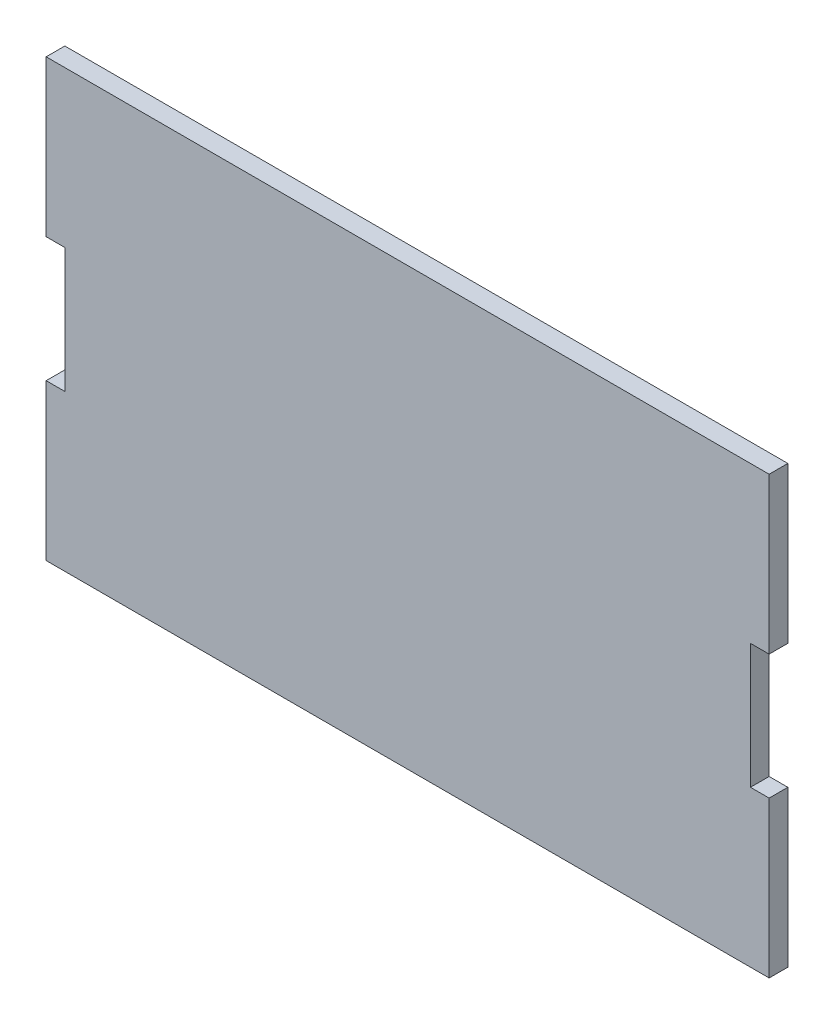
from build123d import *

# Parameters (mm, degrees)
BOSS_EXTRUDE1_DEPTH = 3
SKETCH3_W           = 3
SKETCH3_H           = 20
CUT_EXTRUDE1_DEPTH  = 10


with BuildPart() as part:
    # Sketch2 → Boss-Extrude1 (new body)
    with BuildSketch(Plane.XY):
        Polygon((61.131293058, 0), (61.131293058, -35), (-54.868706942, -35), (-54.868706942, 35), (61.131293058, 35), align=None)
    extrude(amount=BOSS_EXTRUDE1_DEPTH)

    # Sketch3 → Cut-Extrude1 (cut)
    with BuildSketch(Plane.XY.offset(3)):
        with Locations((59.631293058, 0)):
            Rectangle(SKETCH3_W, SKETCH3_H)
        with Locations((-53.368706942, 0)):
            Rectangle(SKETCH3_W, SKETCH3_H)
    extrude(amount=-CUT_EXTRUDE1_DEPTH, mode=Mode.SUBTRACT)


solid = part.part
